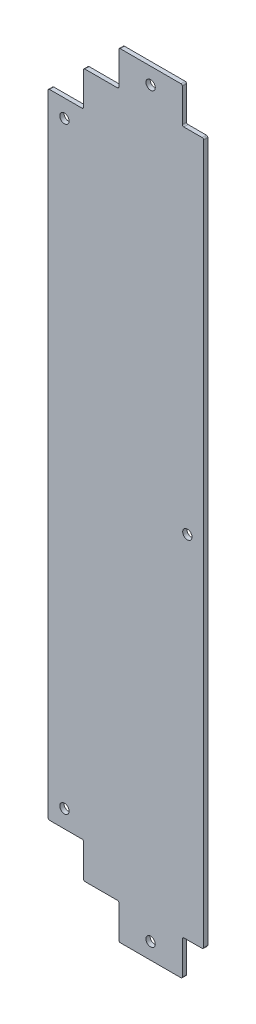
from build123d import *

# Parameters (mm, degrees)
BOSS_EXTRUDE1_DEPTH  = 3
M6_CLEARANCE_HOLE1_D = 6.6
M6_CLEARANCE_HOLE2_D = 6.6


with BuildPart() as part:
    # Sketch1 → Boss-Extrude1 (new body)
    with BuildSketch(Plane.XY):
        with BuildLine():
            Line((26, 473), (49, 473))
            ThreePointArc((49, 473), (49.707106781, 473.292893219), (50, 474))
            Line((50, 474), (50, 497))
            ThreePointArc((50, 497), (50.292893219, 497.707106781), (51, 498))
            Line((51, 498), (94, 498))
            ThreePointArc((94, 498), (94.707106781, 497.707106781), (95, 497))
            Line((95, 497), (95, 473.5))
            ThreePointArc((95, 473.5), (95.292893219, 472.792893219), (96, 472.5))
            Line((96, 472.5), (109, 472.5))
            ThreePointArc((109, 472.5), (109.707106781, 472.207106781), (110, 471.5))
            Line((110, 471.5), (110, -23.5))
            ThreePointArc((110, -23.5), (109.707106781, -24.207106781), (109, -24.5))
            Line((109, -24.5), (96, -24.5))
            ThreePointArc((96, -24.5), (95.292893219, -24.792893219), (95, -25.5))
            Line((95, -25.5), (95, -49))
            ThreePointArc((95, -49), (94.707106781, -49.707106781), (94, -50))
            Line((94, -50), (51, -50))
            ThreePointArc((51, -50), (50.292893219, -49.707106781), (50, -49))
            Line((50, -49), (50, -26))
            ThreePointArc((50, -26), (49.707106781, -25.292893219), (49, -25))
            Line((49, -25), (26, -25))
            ThreePointArc((26, -25), (25.292893219, -24.707106781), (25, -24))
            Line((25, -24), (25, -1))
            ThreePointArc((25, -1), (24.707106781, -0.292893219), (24, 0))
            Line((24, 0), (1, 0))
            ThreePointArc((1, 0), (0.292893219, 0.292893219), (0, 1))
            Line((0, 1), (0, 447))
            ThreePointArc((0, 447), (0.292893219, 447.707106781), (1, 448))
            Line((1, 448), (24, 448))
            ThreePointArc((24, 448), (24.707106781, 448.292893219), (25, 449))
            Line((25, 449), (25, 472))
            ThreePointArc((25, 472), (25.292893219, 472.707106781), (26, 473))
        make_face()
    extrude(amount=BOSS_EXTRUDE1_DEPTH)

    # M6 Clearance Hole1 (through all)
    with Locations(Plane(origin=(0, 0, 0), x_dir=(-1, 0, 0), z_dir=(0, 0, -1))):
        with Locations((-72.5, -38.5), (-11.5, 12.5), (-11.5, 435.5), (-72.5, 486.5)):
            Hole(M6_CLEARANCE_HOLE1_D / 2)

    # M6 Clearance Hole2 (through all)
    with Locations(Plane(origin=(0, 0, 0), x_dir=(-1, 0, 0), z_dir=(0, 0, -1))):
        with Locations((-98.5, 224)):
            Hole(M6_CLEARANCE_HOLE2_D / 2)


solid = part.part
